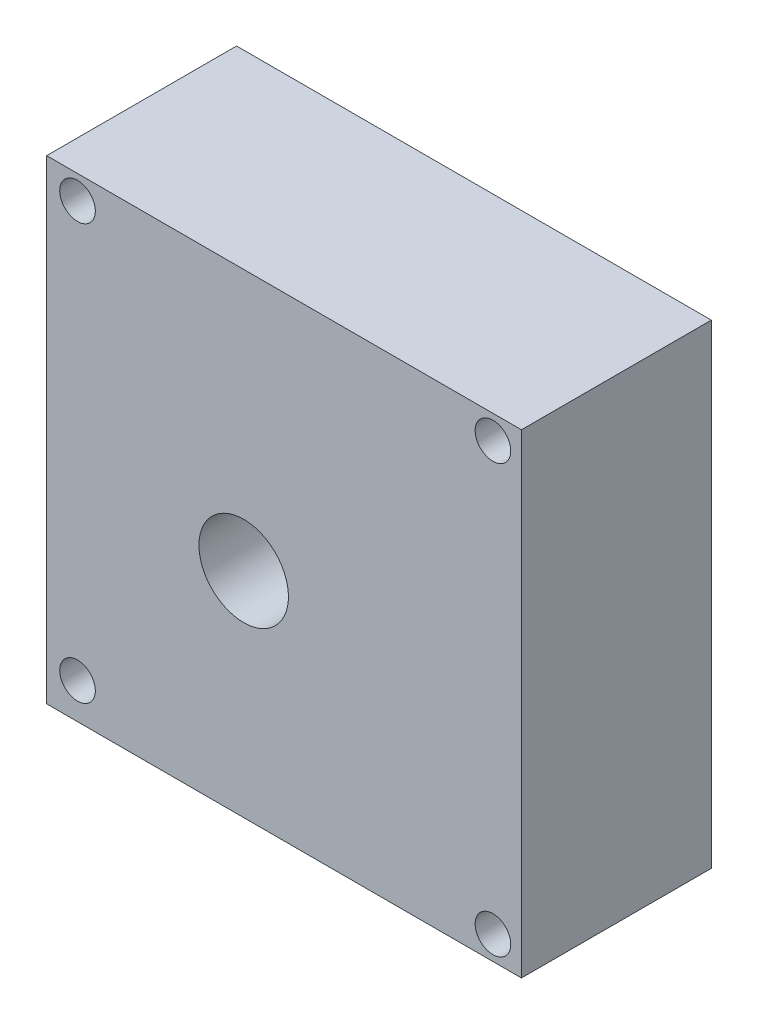
from build123d import *

# Parameters (mm, degrees)
SKETCH7_W               = 50.8
SKETCH7_H               = 50.8
BOSS_EXTRUDE3_DEPTH     = 20.32
SHELL4_T                = -7.62
CUT_EXTRUDE4_DEPTH      = 20.066
CUT_EXTRUDE4_DEPTH_BACK = 73.955945611
SKETCH10_R              = 1.905
SKETCH11_R              = 4.7879
CUT_EXTRUDE5_DEPTH      = 7.62


with BuildPart() as part:
    # Sketch7 → Boss-Extrude3 (new body)
    with BuildSketch(Plane.XY):
        with Locations((25.4, 25.4)):
            Rectangle(SKETCH7_W, SKETCH7_H)
    extrude(amount=BOSS_EXTRUDE3_DEPTH)

    # Shell4
    shell4_openings = [part.faces().sort_by_distance(p)[0] for p in [
        (25.4, 25.4, 0),
    ]]
    offset(amount=SHELL4_T, openings=shell4_openings, kind=Kind.INTERSECTION)

    # Sketch10 → Cut-Extrude4 (cut, two sides: drawn at the far end of the back side and taken through both)
    with BuildSketch(Plane(origin=(0, 0, 12.7), x_dir=(-1, 0, 0), z_dir=(0, 0, -1)).offset(-CUT_EXTRUDE4_DEPTH_BACK)):
        with Locations((-47.752, 48.26)):
            Circle(SKETCH10_R)
        with Locations((-3.302, 48.26)):
            Circle(SKETCH10_R)
        with Locations((-47.752, 2.54)):
            Circle(SKETCH10_R)
        with Locations((-3.302, 3.81)):
            Circle(SKETCH10_R)
    extrude(amount=CUT_EXTRUDE4_DEPTH + CUT_EXTRUDE4_DEPTH_BACK, mode=Mode.SUBTRACT)

    # Sketch11 → Cut-Extrude5 (cut)
    with BuildSketch(Plane(origin=(0, 0, 12.7), x_dir=(-1, 0, 0), z_dir=(0, 0, -1))):
        with Locations((-21.082, 22.86)):
            Circle(SKETCH11_R)
    extrude(amount=-CUT_EXTRUDE5_DEPTH, mode=Mode.SUBTRACT)


solid = part.part
